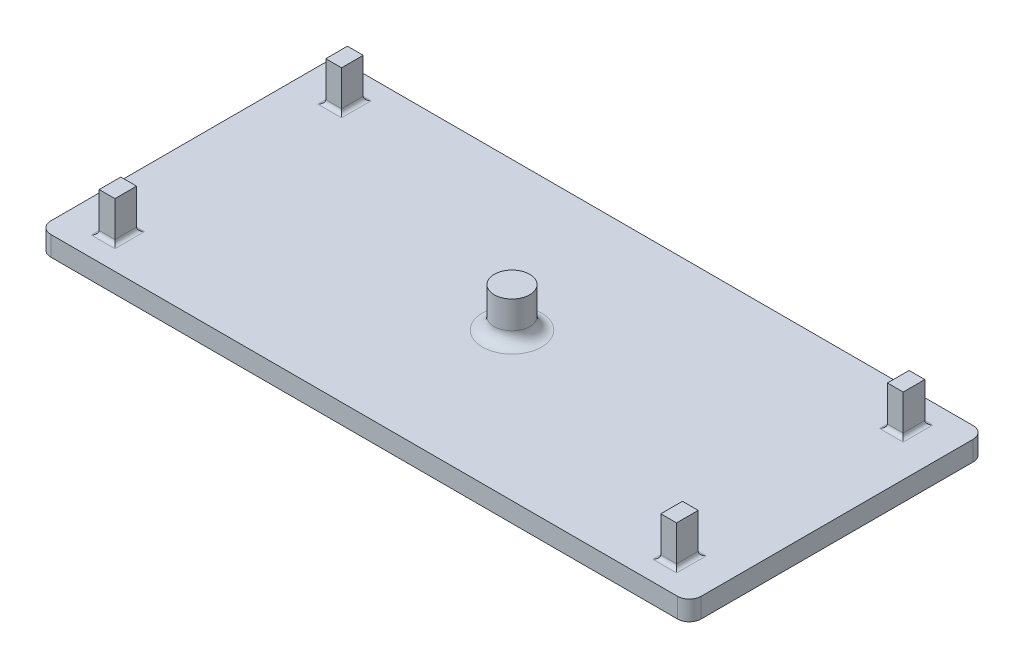
from build123d import *

# Parameters (mm, degrees)
SKETCH1_W           = 165
SKETCH1_H           = 75
BOSS_EXTRUDE1_DEPTH = 5
SKETCH3_W           = 4
SKETCH3_H           = 5.5
SKETCH3_R           = 4.5
BOSS_EXTRUDE3_DEPTH = 10
FILLET2_R           = 3
FILLET4_R           = 3
FILLET5_R           = 1
SKETCH4_R           = 4.5
CUT_EXTRUDE1_DEPTH  = 2


with BuildPart() as part:
    # Sketch1 → Boss-Extrude1 (new body)
    with BuildSketch(Plane(origin=(0, 0, 0), x_dir=(1, 0, 0), z_dir=(0, 1, 0))):
        Rectangle(SKETCH1_W, SKETCH1_H)
    extrude(amount=BOSS_EXTRUDE1_DEPTH)

    # Sketch3 → Boss-Extrude3 (add)
    with BuildSketch(Plane(origin=(0, 5, 0), x_dir=(1, 0, 0), z_dir=(0, 1, 0))):
        with Locations((-71.25, 28.75)):
            Rectangle(SKETCH3_W, SKETCH3_H)
        with Locations((-71.25, -28.75)):
            Rectangle(SKETCH3_W, SKETCH3_H)
        with Locations((71.25, -28.75)):
            Rectangle(SKETCH3_W, SKETCH3_H)
        with Locations((71.25, 28.75)):
            Rectangle(SKETCH3_W, SKETCH3_H)
        Circle(SKETCH3_R)
    extrude(amount=BOSS_EXTRUDE3_DEPTH)

    # Fillet2
    fillet2_edges = [part.edges().sort_by_distance(p)[0] for p in [
        (-4.5, 5, 0),
    ]]
    fillet(fillet2_edges, radius=FILLET2_R)

    # Fillet4
    fillet4_edges = [part.edges().sort_by_distance(p)[0] for p in [
        (-82.5, 2.5, -37.5),
        (82.5, 2.5, 37.5),
        (82.5, 2.5, -37.5),
        (-82.5, 2.5, 37.5),
    ]]
    fillet(fillet4_edges, radius=FILLET4_R)

    # Fillet5
    fillet5_edges = [part.edges().sort_by_distance(p)[0] for p in [
        (-73.25, 5, 28.75),
        (-71.25, 5, 26),
        (-69.25, 5, 28.75),
        (-71.25, 5, 31.5),
        (-71.25, 5, -26),
        (-73.25, 5, -28.75),
        (-71.25, 5, -31.5),
        (-69.25, 5, -28.75),
        (73.25, 5, -28.75),
        (71.25, 5, -31.5),
        (69.25, 5, -28.75),
        (71.25, 5, -26),
        (71.25, 5, 31.5),
        (69.25, 5, 28.75),
        (73.25, 5, 28.75),
        (71.25, 5, 26),
    ]]
    fillet(fillet5_edges, radius=FILLET5_R)

    # Sketch4 → Cut-Extrude1 (cut)
    with BuildSketch(Plane.XZ):
        with Locations((-22.5, -32.5)):
            Circle(SKETCH4_R)
        with Locations((-22.5, 32.5)):
            Circle(SKETCH4_R)
        with Locations((22.5, 32.5)):
            Circle(SKETCH4_R)
        with Locations((22.5, -32.5)):
            Circle(SKETCH4_R)
    extrude(amount=-CUT_EXTRUDE1_DEPTH, mode=Mode.SUBTRACT)


solid = part.part
